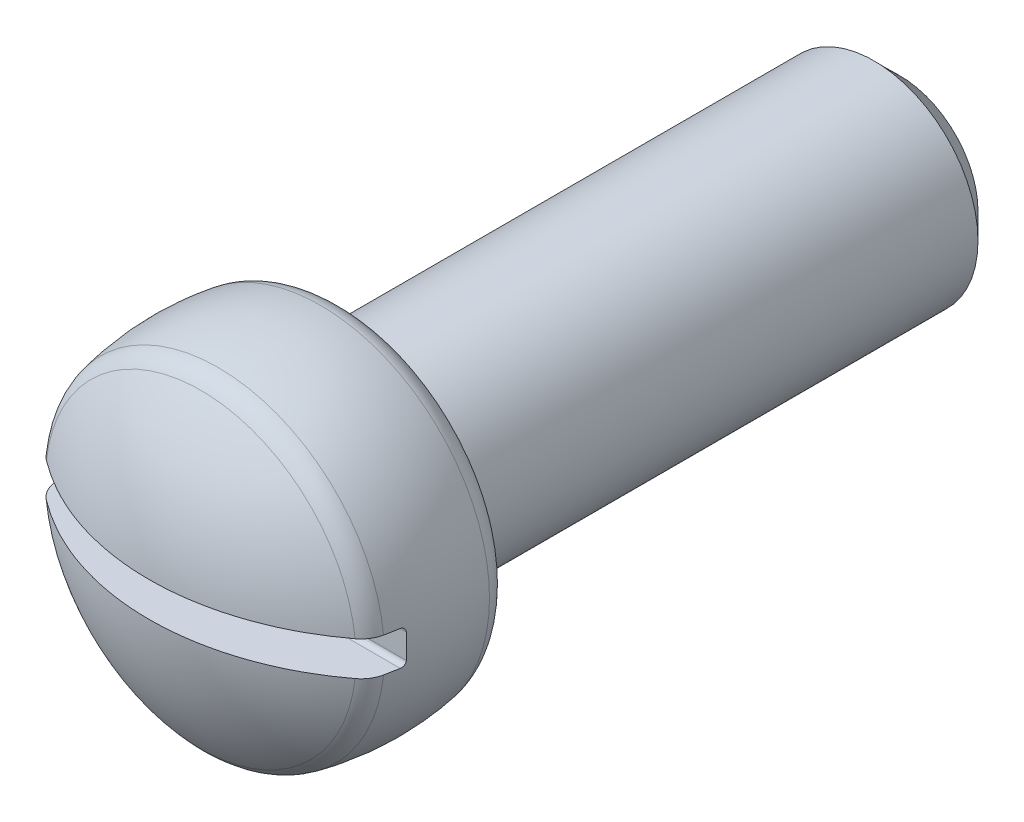
from build123d import *

# Parameters (mm, degrees)
CUT_EXTRUDE1_DEPTH      = 21.516664352
CUT_EXTRUDE1_DEPTH_BACK = 21.516664352
SKETCH9_W               = 4.05765
SKETCH9_H               = 1.57988
FILLET1_R               = 0.225425
FILLET2_R               = 1.35255


with BuildPart() as part:
    # Sketch2 → Revolve1 (revolve)
    with BuildSketch(Plane(origin=(0, 0, 0), x_dir=(0, 0, -1), z_dir=(1, 0, 0))):
        with BuildLine():
            Line((-8.1915, 7.50443), (-8.1915, 4.85775))
            Line((-8.1915, 4.85775), (-6.9215, 4.85775))
            Line((-6.9215, 4.85775), (-6.9215, 4.7625))
            Line((-6.9215, 4.7625), (16.017875, 4.7625))
            Line((16.017875, 4.7625), (17.2085, 3.571875))
            Line((17.2085, 3.571875), (17.2085, 0))
            Line((17.2085, 0), (-17.2085, 0))
            ThreePointArc((-17.2085, 0), (-16.511577735, 3.988547218), (-14.5034, 7.50443))
            ThreePointArc((-14.5034, 7.50443), (-11.34745, 7.8994), (-8.1915, 7.50443))
        make_face()
    revolve(axis=Axis((0, 0, 17.2085), (0, 0, -1)))

    # Sketch9 → Cut-Extrude1 (cut, two sides: drawn at the far end of the back side and taken through both)
    with BuildSketch(Plane(origin=(0, 0, 0), x_dir=(0, 0, -1), z_dir=(1, 0, 0)).offset(-CUT_EXTRUDE1_DEPTH_BACK)):
        with Locations((-15.179675, 0)):
            Rectangle(SKETCH9_W, SKETCH9_H)
    extrude(amount=CUT_EXTRUDE1_DEPTH + CUT_EXTRUDE1_DEPTH_BACK, mode=Mode.SUBTRACT)

    # Fillet1
    fillet1_edges = [part.edges().sort_by_distance(p)[0] for p in [
        (0, 0.78994, 13.15085),
        (0, -0.78994, 13.15085),
    ]]
    fillet(fillet1_edges, radius=FILLET1_R)

    # Fillet2
    fillet2_edges = [part.edges().sort_by_distance(p)[0] for p in [
        (0, -7.50443, 8.1915),
        (0, -7.50443, 14.5034),
        (5.019383438, 5.578732789, 14.5034),
    ]]
    fillet(fillet2_edges, radius=FILLET2_R)


solid = part.part
